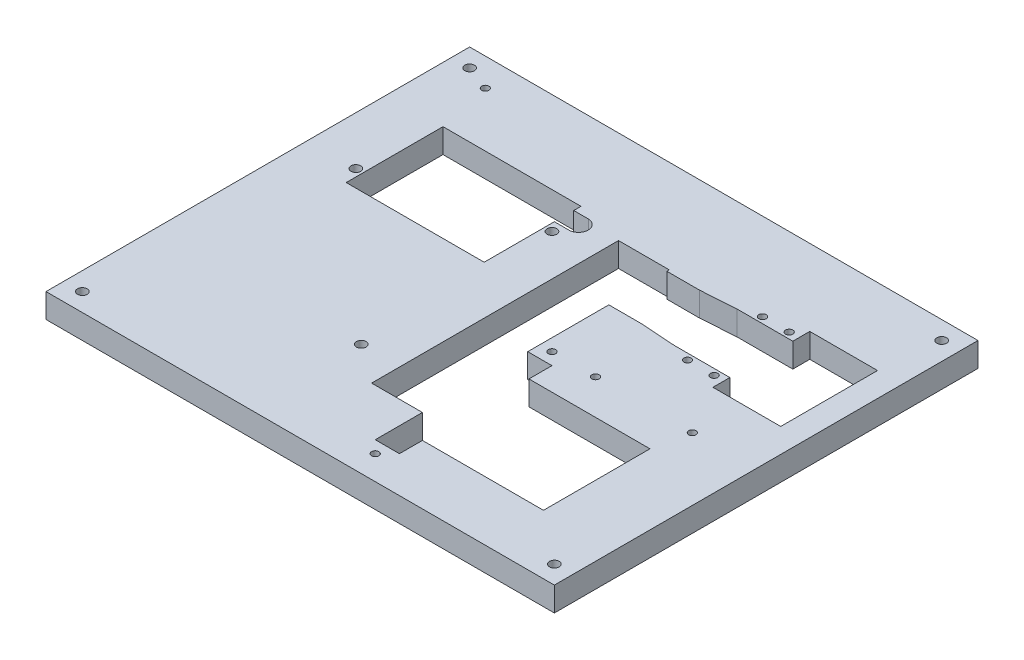
from build123d import *

# Parameters (mm, degrees)
SKETCH_1_W      = 210
SKETCH_1_H      = 175
SKETCH_1_R      = 1.5
SKETCH_1_R_2    = 2
EXTRUDE_1_DEPTH = 10


with BuildPart() as part:
    # Эскиз1 → Бобышка-Вытянуть1 (new body)
    with BuildSketch(Plane(origin=(0, 0, 0), x_dir=(1, 0, 0), z_dir=(0, 1, 0))):
        with Locations((-57.5, -36)):
            Rectangle(SKETCH_1_W, SKETCH_1_H)
        with Locations(Location((-5.5, 15.5, 0), (0, 0, 270))):
            Circle(SKETCH_1_R, mode=Mode.SUBTRACT)
        with Locations(Location((5.5, 15.5, 0), (0, 0, 270))):
            Circle(SKETCH_1_R, mode=Mode.SUBTRACT)
        with Locations(Location((-5.5, -15.5, 0), (0, 0, 270))):
            Circle(SKETCH_1_R, mode=Mode.SUBTRACT)
        with Locations(Location((5.5, -15.5, 0), (0, 0, 270))):
            Circle(SKETCH_1_R, mode=Mode.SUBTRACT)
        with Locations(Location((-36.5, -40.5, 0), (0, 0, 270))):
            Circle(SKETCH_1_R, mode=Mode.SUBTRACT)
        with Locations(Location((-36.5, -113.5, 0), (0, 0, 270))):
            Circle(SKETCH_1_R, mode=Mode.SUBTRACT)
        with Locations(Location((-144.5, 40, 0), (0, 0, 270))):
            Circle(SKETCH_1_R, mode=Mode.SUBTRACT)
        with Locations(Location((-79.5, 2.5, 0), (0, 0, 270))):
            Circle(SKETCH_1_R_2, mode=Mode.SUBTRACT)
        with Locations(Location((-142.5, -15.5, 0), (0, 0, 270))):
            Circle(SKETCH_1_R_2, mode=Mode.SUBTRACT)
        with Locations(Location((-18.5, -40.5, 0), (0, 0, 270))):
            Circle(SKETCH_1_R, mode=Mode.SUBTRACT)
        with Locations(Location((21.5, -40.5, 0), (0, 0, 270))):
            Circle(SKETCH_1_R, mode=Mode.SUBTRACT)
        with Locations(Location((-155, 44, 0), (0, 0, 270))):
            Circle(SKETCH_1_R_2, mode=Mode.SUBTRACT)
        with Locations(Location((40, 44, 0), (0, 0, 270))):
            Circle(SKETCH_1_R_2, mode=Mode.SUBTRACT)
        with Locations(Location((40, -116, 0), (0, 0, 270))):
            Circle(SKETCH_1_R_2, mode=Mode.SUBTRACT)
        with Locations(Location((-155, -116, 0), (0, 0, 270))):
            Circle(SKETCH_1_R_2, mode=Mode.SUBTRACT)
        with Locations(Location((-78.518280062, -77.24520536, 0), (0, 0, 270))):
            Circle(SKETCH_1_R_2, mode=Mode.SUBTRACT)
        Polygon((-13.5, 13), (-28, 12), (-41.5, 12), (-41.5, 13), (-62.5, 13), (-62.5, -89), (-41.5, -89), (-41.5, -108.5), (-31.5, -108.5), (-31.5, -99), (18.5, -99), (18.5, -55), (-31.5, -55), (-31.5, -45.5), (-41.5, -45.5), (-41.5, -12), (-28, -12), (-13.5, -13), (9.5, -13), (9.5, -20), (37.5, -20), (37.5, 20), (9.5, 20), (9.5, 13), align=None, mode=Mode.SUBTRACT)
        with BuildLine():
            Line((-82.5, 17.5), (-82.5, 14.5))
            Line((-82.5, 14.5), (-76.5, 14.5))
            ThreePointArc((-76.5, 14.5), (-72.5, 10.5), (-76.5, 6.5))
            Line((-76.5, 6.5), (-82.5, 6.5))
            Line((-82.5, 6.5), (-82.5, -22.5))
            Line((-82.5, -22.5), (-139.5, -22.5))
            Line((-139.5, -22.5), (-139.5, 17.5))
            Line((-139.5, 17.5), (-82.5, 17.5))
        make_face(mode=Mode.SUBTRACT)
    extrude(amount=EXTRUDE_1_DEPTH)


solid = part.part
